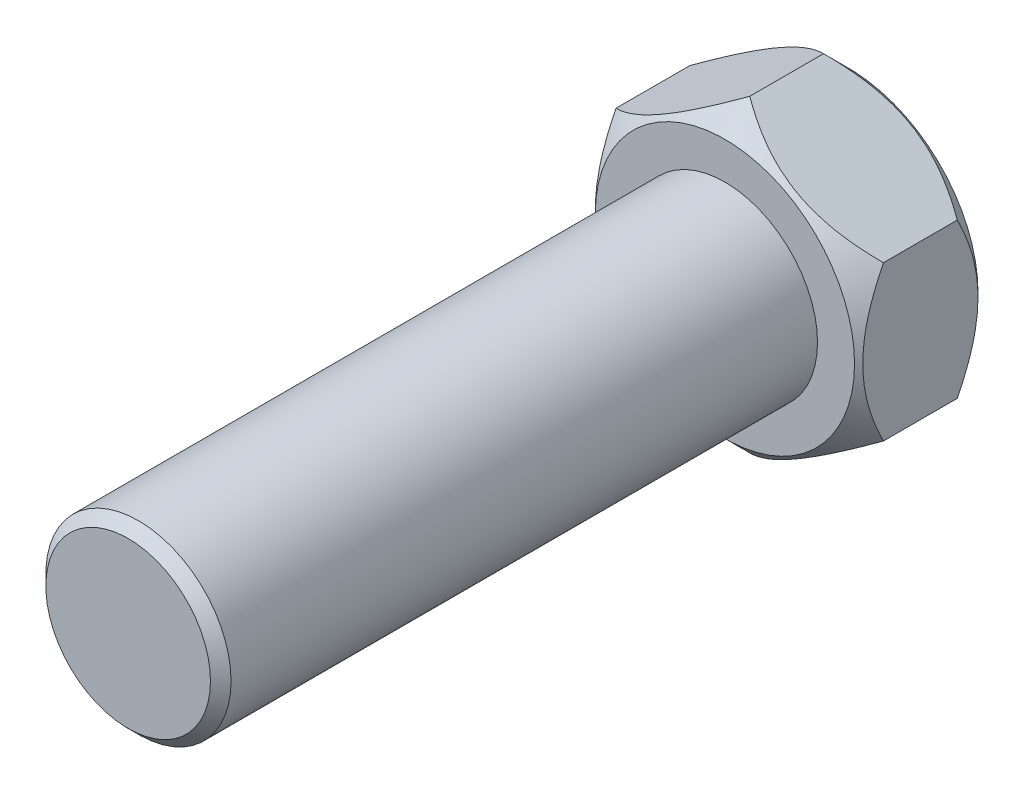
from build123d import *

# Parameters (mm, degrees)
SKETCH1_R           = 5.715
BOSS_EXTRUDE1_DEPTH = 36.83
BOSS_EXTRUDE2_DEPTH = 7.62
CHAMFER1_SIZE       = 0.635


with BuildPart() as part:
    # Sketch1 → Boss-Extrude1 (new body)
    with BuildSketch(Plane.XY):
        Circle(SKETCH1_R)
    extrude(amount=BOSS_EXTRUDE1_DEPTH)

    # Sketch1<3> → Boss-Extrude2 (add)
    with BuildSketch(Plane.XY):
        Polygon((-8.255, -4.766026472), (0, -9.532052944), (8.255, -4.766026472), (8.255, 4.766026472), (0, 9.532052944), (-8.255, 4.766026472), align=None)
    extrude(amount=-BOSS_EXTRUDE2_DEPTH)

    # Sketch2 → Cut-Revolve1 (revolve, cut)
    with BuildSketch(Plane(origin=(0, 0, 0), x_dir=(1, 0, 0), z_dir=(0, 1, 0))):
        Polygon((8.001, 0), (11.811, 3.81), (8.001, 7.62), (14.351, 7.62), (14.351, 0), align=None)
    revolve(axis=Axis((0, 0, 0), (0, 0, -1)), mode=Mode.SUBTRACT)

    # Chamfer1
    chamfer1_edges = [part.edges().sort_by_distance(p)[0] for p in [
        (-5.715, 0, 36.83),
    ]]
    chamfer(chamfer1_edges, length=CHAMFER1_SIZE)


solid = part.part
